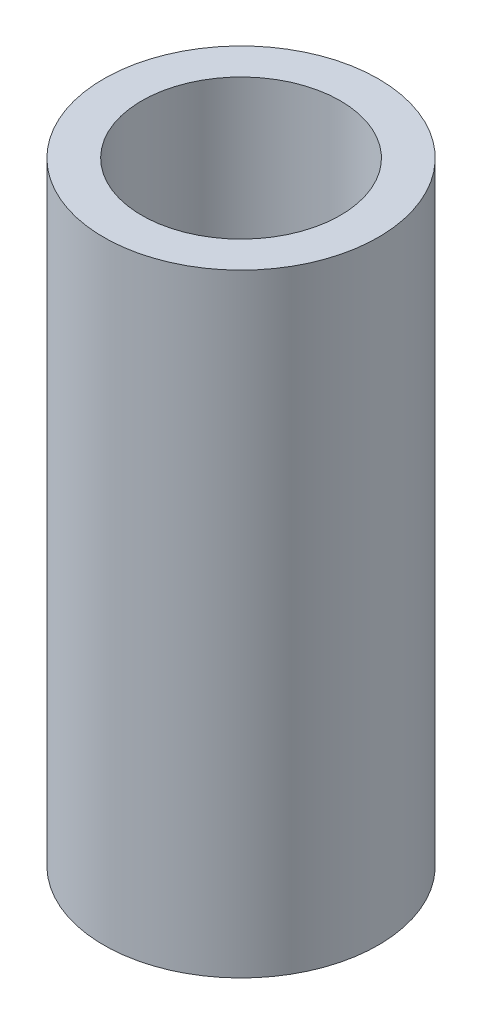
from build123d import *

# Parameters (mm, degrees)
SKETCH1_W = 1.55
SKETCH1_H = 25


with BuildPart() as part:
    # Sketch1 → Revolve1 (revolve)
    with BuildSketch(Plane.XY, mode=Mode.PRIVATE) as revolve1_sk:
        with Locations((4.825, 12.5)):
            Rectangle(SKETCH1_W, SKETCH1_H)
    revolve(revolve1_sk.sketch.rotate(Axis((0, 0, 0), (0, 1, 0)), 90), axis=Axis((0, 0, 0), (0, 1, 0)))


solid = part.part
